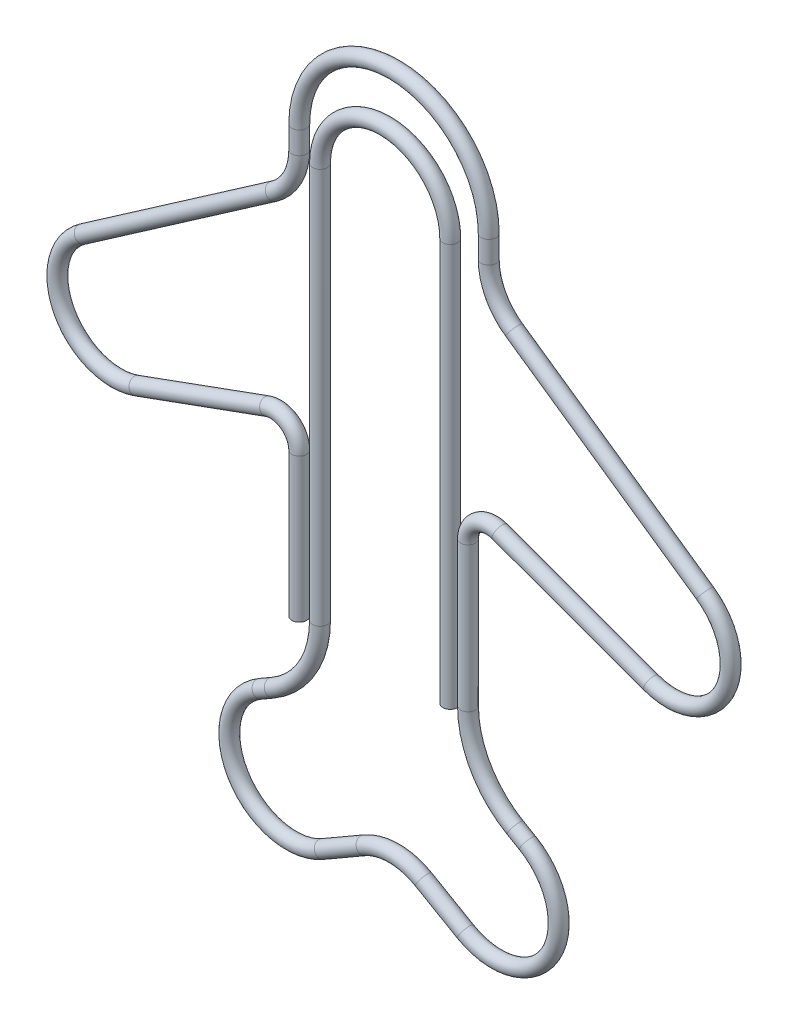
from build123d import *

# Parameters (mm, degrees)
SKETCH_3_R = 1.25


with BuildPart() as part:
    # По траектории1: sweep along a path in Эскиз2
    with BuildLine(Plane.XY) as sweep_1_path:
        Line((-16, -12), (-16, 12.287407973))
        ThreePointArc((-16, 12.287407973), (-17.705694255, 15.56401615), (-21.368080573, 16.046178456))
        Line((-21.368080573, 16.046178456), (-43.446904203, 8.010143847))
        ThreePointArc((-43.446904203, 8.010143847), (-55.746885537, 12.808210531), (-52.568435085, 25.622594537))
        Line((-52.568435085, 25.622594537), (-20.298670551, 48.016850591))
        ThreePointArc((-20.298670551, 48.016850591), (-17.139602309, 51.596282671), (-16, 56.232375073))
        Line((-16, 56.232375073), (-16, 60))
        ThreePointArc((-16, 60), (0, 76), (16, 60))
        Line((16, 60), (16, 56.232375073))
        ThreePointArc((16, 56.232375073), (17.139602309, 51.596282671), (20.298670551, 48.016850591))
        Line((20.298670551, 48.016850591), (52.568435085, 25.622594537))
        ThreePointArc((52.568435085, 25.622594537), (55.746885537, 12.808210531), (43.446904203, 8.010143847))
        Line((43.446904203, 8.010143847), (17.868080573, 17.320074276))
        ThreePointArc((17.868080573, 17.320074276), (14.205694255, 16.83791197), (12.5, 13.561303793))
        Line((12.5, 13.561303793), (12.5, -10.854918405))
        ThreePointArc((12.5, -10.854918405), (14.643593539, -18.854918405), (20.5, -24.711324865))
        Line((20.5, -24.711324865), (22.570508076, -25.90673326))
        ThreePointArc((22.570508076, -25.90673326), (26.413774815, -40.25), (12.070508076, -44.09326674))
        Line((12.070508076, -44.09326674), (5, -40.011106999))
        ThreePointArc((5, -40.011106999), (0, -38.671361037), (-5, -40.011106999))
        Line((-5, -40.011106999), (-12.070508076, -44.09326674))
        ThreePointArc((-12.070508076, -44.09326674), (-26.413774815, -40.25), (-22.570508076, -25.90673326))
        Line((-22.570508076, -25.90673326), (-20.5, -24.711324865))
        ThreePointArc((-20.5, -24.711324865), (-14.643593539, -18.854918405), (-12.5, -10.854918405))
        Line((-12.5, -10.854918405), (-12.5, 25))
        Line((-12.5, 25), (-12.5, 56))
        ThreePointArc((-12.5, 56), (-1.5, 67), (9.5, 56))
        Line((9.5, 56), (9.5, -12))
    # Эскиз3 → По траектории1 (sweep)
    with BuildSketch(Plane(origin=(9.5, -12, 0), x_dir=(-1, 0, 0), z_dir=(0, -1, 0))):
        Circle(SKETCH_3_R)
    sweep(path=sweep_1_path.line)


solid = part.part
